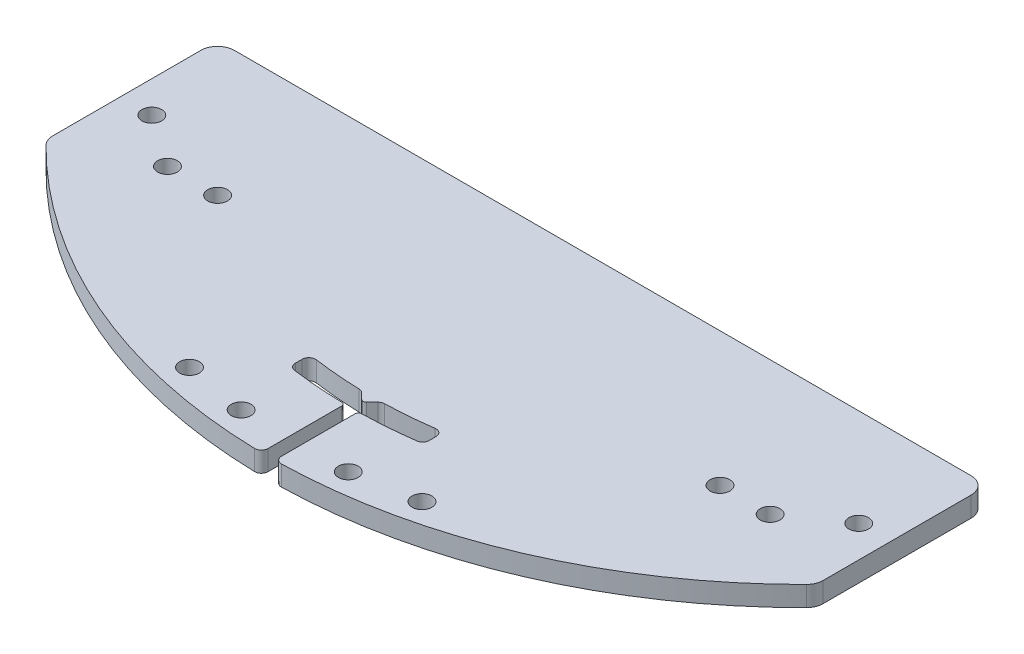
from build123d import *

# Parameters (mm, degrees)
SKETCH1_W             = 10
SKETCH1_H             = 10
BOSS_EXTRUDE1_DEPTH   = 2.5
BOSS_EXTRUDE1_2_DEPTH = 2.5
BOSS_EXTRUDE2_DEPTH   = 3
F_2_CLEARANCE_HOLE1_D = 2.9464
FILLET1_R             = 2.5
F_2_CLEARANCE_HOLE2_D = 2.9464
CUT_EXTRUDE1_DEPTH    = 66.097235732
FILLET2_R             = 1
FILLET3_R             = 0.5


with BuildPart() as part:
    # Sketch1 → Boss-Extrude1 (new body)
    with BuildSketch(Plane(origin=(0, 0, 0), x_dir=(1, 0, 0), z_dir=(0, 1, 0))):
        with Locations((-37.51, 0)):
            Rectangle(SKETCH1_W, SKETCH1_H)
    extrude(amount=BOSS_EXTRUDE1_DEPTH)



with BuildPart() as body_2:
    # Sketch1 → Boss-Extrude1 2 (new body)
    with BuildSketch(Plane(origin=(0, 0, 0), x_dir=(1, 0, 0), z_dir=(0, 1, 0))):
        with Locations((37.51, 0)):
            Rectangle(SKETCH1_W, SKETCH1_H)
    extrude(amount=BOSS_EXTRUDE1_2_DEPTH)


with BuildPart() as part_1:
    add(part.part)

    add(body_2.part)  # Boss-Extrude2 merges body 2
    # Sketch2 → Boss-Extrude2 (add)
    with BuildSketch(Plane(origin=(0, 2.5, 0), x_dir=(1, 0, 0), z_dir=(0, 1, 0))):
        with BuildLine():
            Line((-57.51, -5.611149062), (-57.51, 20))
            Line((-57.51, 20), (57.51, 20))
            Line((57.51, 20), (57.51, -5.611149062))
            ThreePointArc((57.51, -5.611149062), (0, -30), (-57.51, -5.611149062))
        make_face()
    extrude(amount=BOSS_EXTRUDE2_DEPTH)

    # #2 Clearance Hole1 (through all)
    with Locations(Plane(origin=(0, 5.5, 0), x_dir=(1, 0, 0), z_dir=(0, 1, 0))):
        with Locations((17.355673654, -24.350342312), (-17.355673654, -24.350342312), (-8, -26), (-52.781944421, 5.448976145), (-45, 0), (45, 0), (52.781944421, 5.448976145), (8, -26)):
            Hole(F_2_CLEARANCE_HOLE1_D / 2)

    # Fillet1
    fillet1_edges = [part_1.edges().sort_by_distance(p)[0] for p in [
        (-57.51, 4, 5.611149062),
        (57.51, 4, 5.611149062),
        (57.51, 4, -20),
        (-57.51, 4, -20),
        (32.51, 1.25, -5),
        (32.51, 1.25, 5),
        (42.51, 1.25, 5),
        (42.51, 1.25, -5),
        (-32.51, 1.25, 5),
        (-42.51, 1.25, 5),
        (-42.51, 1.25, -5),
        (-32.51, 1.25, -5),
    ]]
    fillet(fillet1_edges, radius=FILLET1_R)

    # #2 Clearance Hole2 (through all)
    with Locations(Plane(origin=(0, 5.5, 0), x_dir=(1, 0, 0), z_dir=(0, 1, 0))):
        with Locations((-37.51, 0), (37.51, 0)):
            Hole(F_2_CLEARANCE_HOLE2_D / 2)

    # Sketch7 → Cut-Extrude1 (cut, through all)
    with BuildSketch(Plane(origin=(0, 5.5, 0), x_dir=(1, 0, 0), z_dir=(0, 1, 0))):
        with BuildLine():
            Line((-1, -17.5), (-1, -29.993749756))
            Line((-1, -29.993749756), (0, -30))
            Line((0, -30), (1, -29.993749756))
            Line((1, -29.993749756), (1, -17.5))
            ThreePointArc((1, -17.5), (5.512342988, -17.281974367), (10, -16.762639253))
            Line((10, -16.762639253), (10, -13.727588672))
            ThreePointArc((10, -13.727588672), (5.762621308, -14.249496135), (1.5, -14.489964785))
            Line((1.5, -14.489964785), (0, -15.989964785))
            Line((0, -15.989964785), (-1.5, -14.489964785))
            ThreePointArc((-1.5, -14.489964785), (-5.762621308, -14.249496135), (-10, -13.727588672))
            Line((-10, -13.727588672), (-10, -16.762639253))
            ThreePointArc((-10, -16.762639253), (-5.512342988, -17.281974367), (-1, -17.5))
        make_face()
    extrude(amount=-CUT_EXTRUDE1_DEPTH, mode=Mode.SUBTRACT)


with BuildPart() as cut_extrude1_kept_piece:
    # of the separate pieces the step leaves, the one the design keeps (cut_extrude1_pieces_kept)
    add(part_1.part.solids().sort_by_distance((-57.51, 2.5, 4.590749216))[0])

    # Fillet2
    fillet2_edges = [cut_extrude1_kept_piece.edges().sort_by_distance(p)[0] for p in [
        (10, 4, 13.727588672),
        (10, 4, 16.762639253),
        (1, 4, 29.993749756),
        (-1, 4, 29.993749756),
        (-10, 4, 16.762639253),
        (-1.5, 4, 14.489964785),
        (1.5, 4, 14.489964785),
        (-10, 4, 13.727588672),
    ]]
    fillet(fillet2_edges, radius=FILLET2_R)

    # Fillet3
    fillet3_edges = [cut_extrude1_kept_piece.edges().sort_by_distance(p)[0] for p in [
        (1, 4, 17.5),
        (-1, 4, 17.5),
        (0, 4, 15.989964785),
    ]]
    fillet(fillet3_edges, radius=FILLET3_R)


solid = cut_extrude1_kept_piece.part
